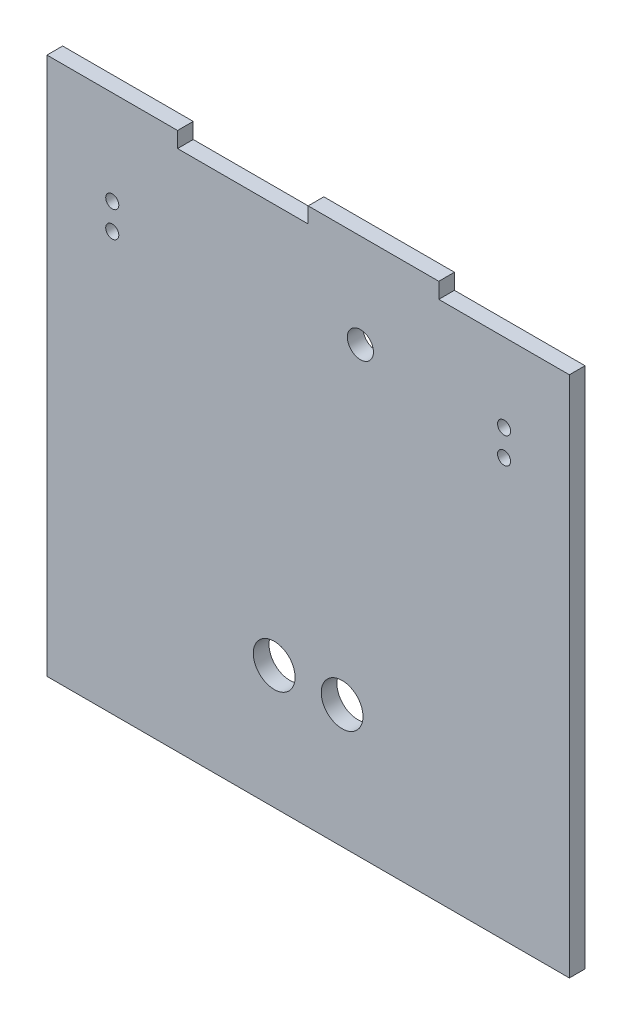
from build123d import *

# Parameters (mm, degrees)
ESQUISSE1_R        = 2.5
ESQUISSE1_R_2      = 5
ESQUISSE1_R_3      = 8
BOSS_EXTRU_1_DEPTH = 6


with BuildPart() as part:
    # Esquisse1 → Boss.-Extru.1 (new body)
    with BuildSketch(Plane.XY):
        Polygon((0, 0), (200, 0), (200, 200), (150, 200), (150, 206), (100, 206), (100, 200), (50, 200), (50, 206), (0, 206), align=None)
        with Locations((175, 170)):
            Circle(ESQUISSE1_R, mode=Mode.SUBTRACT)
        with Locations((175, 160)):
            Circle(ESQUISSE1_R, mode=Mode.SUBTRACT)
        with Locations((25, 170)):
            Circle(ESQUISSE1_R, mode=Mode.SUBTRACT)
        with Locations((25, 160)):
            Circle(ESQUISSE1_R, mode=Mode.SUBTRACT)
        with Locations((120, 170)):
            Circle(ESQUISSE1_R_2, mode=Mode.SUBTRACT)
        with Locations((87, 47.14998282)):
            Circle(ESQUISSE1_R_3, mode=Mode.SUBTRACT)
        with Locations((113, 47.14998282)):
            Circle(ESQUISSE1_R_3, mode=Mode.SUBTRACT)
    extrude(amount=BOSS_EXTRU_1_DEPTH)


solid = part.part
